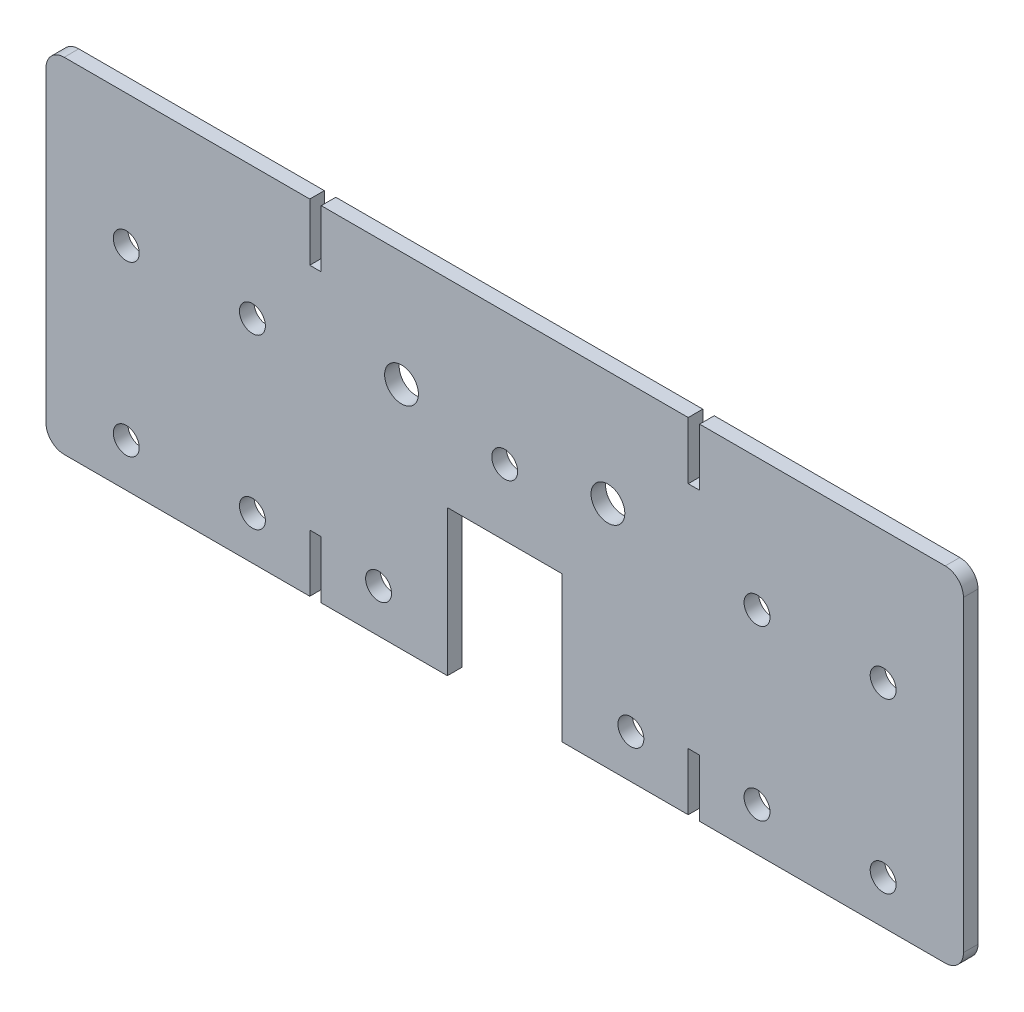
from build123d import *

# Parameters (mm, degrees)
SKETCH1_R           = 1.1303
SKETCH1_R_2         = 1.4732
BOSS_EXTRUDE1_DEPTH = 1.27
FILLET1_R           = 1.5875


with BuildPart() as part:
    # Sketch1 → Boss-Extrude1 (new body)
    with BuildSketch(Plane.XY):
        Polygon((23, 0), (0, 0), (0, -30), (23, -30), (23, -25), (24, -25), (24, -30), (35, -30), (35, -17.3), (45, -17.3), (45, -30), (56, -30), (56, -25), (57, -25), (57, -30), (80, -30), (80, 0), (57, 0), (57, -5), (56, -5), (56, 0), (24, 0), (24, -5), (23, -5), align=None)
        with Locations((7, -26.225)):
            Circle(SKETCH1_R, mode=Mode.SUBTRACT)
        with Locations((18, -26.225)):
            Circle(SKETCH1_R, mode=Mode.SUBTRACT)
        with Locations((29, -26.225)):
            Circle(SKETCH1_R, mode=Mode.SUBTRACT)
        with Locations((51, -26.225)):
            Circle(SKETCH1_R, mode=Mode.SUBTRACT)
        with Locations((62, -26.225)):
            Circle(SKETCH1_R, mode=Mode.SUBTRACT)
        with Locations((73, -26.225)):
            Circle(SKETCH1_R, mode=Mode.SUBTRACT)
        with Locations((7, -11.525)):
            Circle(SKETCH1_R, mode=Mode.SUBTRACT)
        with Locations((18, -11.525)):
            Circle(SKETCH1_R, mode=Mode.SUBTRACT)
        with Locations((31, -10)):
            Circle(SKETCH1_R_2, mode=Mode.SUBTRACT)
        with Locations((40, -11.525)):
            Circle(SKETCH1_R, mode=Mode.SUBTRACT)
        with Locations((49, -10)):
            Circle(SKETCH1_R_2, mode=Mode.SUBTRACT)
        with Locations((62, -11.525)):
            Circle(SKETCH1_R, mode=Mode.SUBTRACT)
        with Locations((73, -11.525)):
            Circle(SKETCH1_R, mode=Mode.SUBTRACT)
    extrude(amount=BOSS_EXTRUDE1_DEPTH)

    # Fillet1
    fillet1_edges = [part.edges().sort_by_distance(p)[0] for p in [
        (0, -30, 0.635),
        (0, 0, 0.635),
        (80, 0, 0.635),
        (80, -30, 0.635),
    ]]
    fillet(fillet1_edges, radius=FILLET1_R)


solid = part.part
